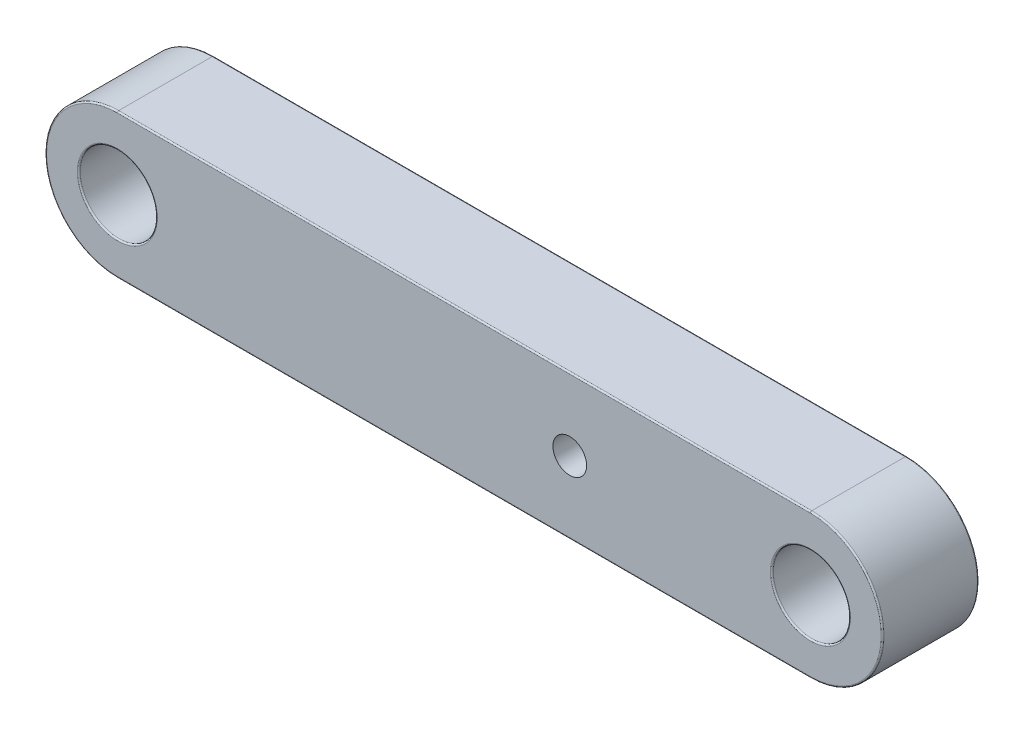
from build123d import *

# Parameters (mm, degrees)
SKETCH1_R           = 4
BOSS_EXTRUDE1_DEPTH = 5
FILLET2_R           = 0.15
SKETCH2_W           = 10
SKETCH2_H           = 7.9994
CUT_EXTRUDE1_DEPTH  = 3
SKETCH3_R           = 1.75
CUT_EXTRUDE2_DEPTH  = 45.69339996


with BuildPart() as part:
    # Sketch1 → Boss-Extrude1 (new, symmetric)
    with BuildSketch(Plane.XY):
        with BuildLine():
            Line((-35.999998845, 7.5), (35.999998845, 7.5))
            ThreePointArc((35.999998845, 7.5), (43.5, 0), (35.999998845, -7.5))
            Line((35.999998845, -7.5), (-35.999998845, -7.5))
            ThreePointArc((-35.999998845, -7.5), (-43.5, 0), (-35.999998845, 7.5))
        make_face()
        with Locations((-36, 0)):
            Circle(SKETCH1_R, mode=Mode.SUBTRACT)
        with Locations((36, 0)):
            Circle(SKETCH1_R, mode=Mode.SUBTRACT)
    extrude(amount=BOSS_EXTRUDE1_DEPTH, both=True)

    # Fillet2
    fillet2_edges = [part.edges().sort_by_distance(p)[0] for p in [
        (-40, 0, -5),
        (-40, 0, 5),
        (-43.5, 0, 5),
        (32, 0, -5),
        (32, 0, 5),
        (0, -7.5, 5),
        (43.5, 0, 5),
        (0, -7.5, -5),
        (-43.5, 0, -5),
        (0, 7.5, -5),
        (43.5, 0, -5),
        (0, 7.5, 5),
    ]]
    fillet(fillet2_edges, radius=FILLET2_R)

    # Sketch2 → Cut-Extrude1 (cut)
    with BuildSketch(Plane(origin=(0, 0, -5), x_dir=(-1, 0, 0), z_dir=(0, 0, -1))):
        with Locations((-11, 0.0003)):
            Rectangle(SKETCH2_W, SKETCH2_H)
    extrude(amount=-CUT_EXTRUDE1_DEPTH, mode=Mode.SUBTRACT)

    # Sketch3 → Cut-Extrude2 (cut, through all)
    with BuildSketch(Plane(origin=(0, 0, -2), x_dir=(-1, 0, 0), z_dir=(0, 0, -1))):
        with Locations((-11, 0.0003)):
            Circle(SKETCH3_R)
    extrude(amount=-CUT_EXTRUDE2_DEPTH, mode=Mode.SUBTRACT)


solid = part.part
